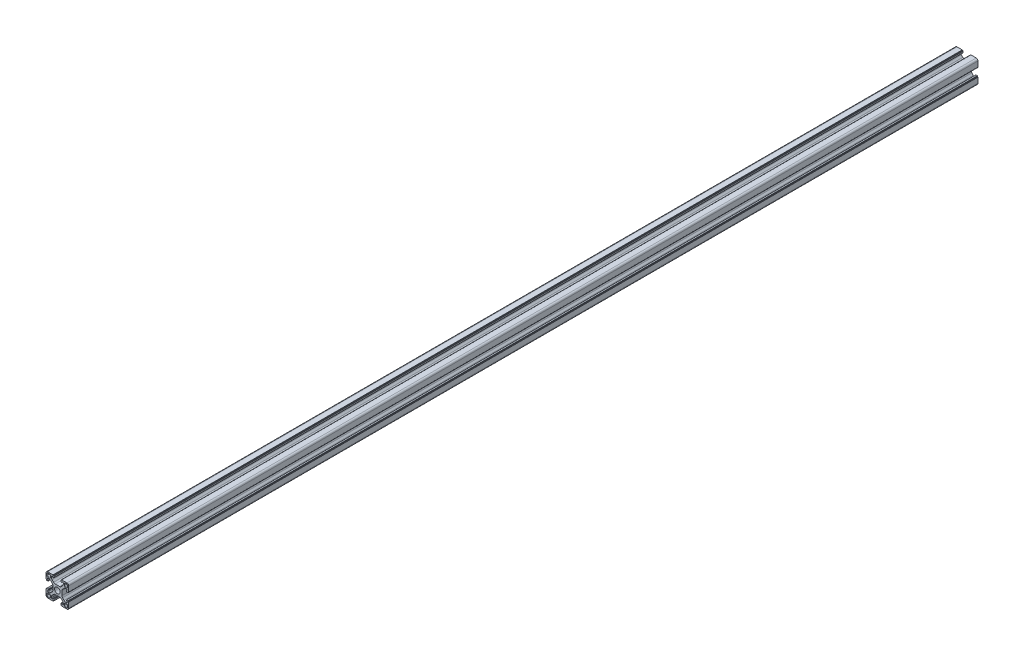
from build123d import *

# Parameters (mm, degrees)
EXTRUDE_1_DEPTH = 800


with BuildPart() as part:
    # Эскиз2 → Бобышка-Вытянуть1 (new body)
    with BuildSketch(Plane.XY):
        with BuildLine():
            Line((0.129852449, 4.683728486), (2.028633118, 4.683728486))
            ThreePointArc((2.028633118, 4.683728486), (2.793999983, 4.835969421), (3.44284668, 5.269514923))
            Line((3.44284668, 5.269514923), (4.744066011, 6.570734254))
            ThreePointArc((4.744066011, 6.570734254), (5.177611514, 7.219580952), (5.329852449, 7.984947817))
            Line((5.329852449, 7.984947817), (5.329852449, 8.883728486))
            ThreePointArc((5.329852449, 8.883728486), (5.183405839, 9.237281876), (4.829852449, 9.383728486))
            Line((4.829852449, 9.383728486), (4.72695923, 9.383728486))
            ThreePointArc((4.72695923, 9.383728486), (4.535617514, 9.345668252), (4.373405839, 9.237281876))
            Line((4.373405839, 9.237281876), (3.893075754, 8.75695179))
            ThreePointArc((3.893075754, 8.75695179), (3.811969916, 8.702758603), (3.716299058, 8.683728486))
            Line((3.716299058, 8.683728486), (3.429852449, 8.683728486))
            ThreePointArc((3.429852449, 8.683728486), (3.253075754, 8.75695179), (3.179852449, 8.933728486))
            Line((3.179852449, 8.933728486), (3.179852449, 10.082799306))
            ThreePointArc((3.179852449, 10.082799306), (3.223786432, 10.188865323), (3.329852449, 10.232799306))
            Line((3.329852449, 10.232799306), (3.829852449, 10.232799306))
            Line((3.829852449, 10.232799306), (3.829852449, 10.533728486))
            ThreePointArc((3.829852449, 10.533728486), (3.873786432, 10.639794503), (3.979852449, 10.683728486))
            Line((3.979852449, 10.683728486), (8.629852449, 10.683728486))
            ThreePointArc((8.629852449, 10.683728486), (9.690512621, 10.244388658), (10.129852449, 9.183728486))
            Line((10.129852449, 9.183728486), (10.129852449, 4.533728486))
            ThreePointArc((10.129852449, 4.533728486), (10.085918466, 4.427662469), (9.979852449, 4.383728486))
            Line((9.979852449, 4.383728486), (9.678923269, 4.383728486))
            Line((9.678923269, 4.383728486), (9.678923269, 3.883728486))
            ThreePointArc((9.678923269, 3.883728486), (9.634989287, 3.777662469), (9.528923269, 3.733728486))
            Line((9.528923269, 3.733728486), (8.379852449, 3.733728486))
            ThreePointArc((8.379852449, 3.733728486), (8.203075754, 3.80695179), (8.129852449, 3.983728486))
            Line((8.129852449, 3.983728486), (8.129852449, 4.270175095))
            ThreePointArc((8.129852449, 4.270175095), (8.148882566, 4.365845953), (8.203075754, 4.44695179))
            Line((8.203075754, 4.44695179), (8.683405839, 4.927281876))
            ThreePointArc((8.683405839, 4.927281876), (8.791792215, 5.089493551), (8.829852449, 5.280835267))
            Line((8.829852449, 5.280835267), (8.829852449, 5.383728486))
            ThreePointArc((8.829852449, 5.383728486), (8.683405839, 5.737281876), (8.329852449, 5.883728486))
            Line((8.329852449, 5.883728486), (7.43107178, 5.883728486))
            ThreePointArc((7.43107178, 5.883728486), (6.665704915, 5.731487551), (6.016858217, 5.297942048))
            Line((6.016858217, 5.297942048), (4.715638886, 3.996722717))
            ThreePointArc((4.715638886, 3.996722717), (4.282093384, 3.34787602), (4.129852449, 2.582509155))
            Line((4.129852449, 2.582509155), (4.129852449, 0.683728486))
            Line((4.129852449, 0.683728486), (4.129852449, -1.215052183))
            ThreePointArc((4.129852449, -1.215052183), (4.282093384, -1.980419048), (4.715638886, -2.629265746))
            Line((4.715638886, -2.629265746), (6.016858217, -3.930485077))
            ThreePointArc((6.016858217, -3.930485077), (6.665704915, -4.364030579), (7.43107178, -4.516271514))
            Line((7.43107178, -4.516271514), (8.329852449, -4.516271514))
            ThreePointArc((8.329852449, -4.516271514), (8.683405839, -4.369824905), (8.829852449, -4.016271514))
            Line((8.829852449, -4.016271514), (8.829852449, -3.913378295))
            ThreePointArc((8.829852449, -3.913378295), (8.791792215, -3.722036579), (8.683405839, -3.559824905))
            Line((8.683405839, -3.559824905), (8.203075754, -3.079494819))
            ThreePointArc((8.203075754, -3.079494819), (8.148882566, -2.998388982), (8.129852449, -2.902718124))
            Line((8.129852449, -2.902718124), (8.129852449, -2.616271514))
            ThreePointArc((8.129852449, -2.616271514), (8.203075754, -2.439494819), (8.379852449, -2.366271514))
            Line((8.379852449, -2.366271514), (9.528923269, -2.366271514))
            ThreePointArc((9.528923269, -2.366271514), (9.634989287, -2.410205497), (9.678923269, -2.516271514))
            Line((9.678923269, -2.516271514), (9.678923269, -3.016271514))
            Line((9.678923269, -3.016271514), (9.979852449, -3.016271514))
            ThreePointArc((9.979852449, -3.016271514), (10.085918466, -3.060205497), (10.129852449, -3.166271514))
            Line((10.129852449, -3.166271514), (10.129852449, -7.816271514))
            ThreePointArc((10.129852449, -7.816271514), (9.690512621, -8.876931686), (8.629852449, -9.316271514))
            Line((8.629852449, -9.316271514), (3.979852449, -9.316271514))
            ThreePointArc((3.979852449, -9.316271514), (3.873786432, -9.272337531), (3.829852449, -9.166271514))
            Line((3.829852449, -9.166271514), (3.829852449, -8.865342335))
            Line((3.829852449, -8.865342335), (3.329852449, -8.865342335))
            ThreePointArc((3.329852449, -8.865342335), (3.223786432, -8.821408352), (3.179852449, -8.715342335))
            Line((3.179852449, -8.715342335), (3.179852449, -7.566271514))
            ThreePointArc((3.179852449, -7.566271514), (3.253075754, -7.389494819), (3.429852449, -7.316271514))
            Line((3.429852449, -7.316271514), (3.716299058, -7.316271514))
            ThreePointArc((3.716299058, -7.316271514), (3.811969916, -7.335301631), (3.893075754, -7.389494819))
            Line((3.893075754, -7.389494819), (4.373405839, -7.869824905))
            ThreePointArc((4.373405839, -7.869824905), (4.535617514, -7.978211281), (4.72695923, -8.016271514))
            Line((4.72695923, -8.016271514), (4.829852449, -8.016271514))
            ThreePointArc((4.829852449, -8.016271514), (5.183405839, -7.869824905), (5.329852449, -7.516271514))
            Line((5.329852449, -7.516271514), (5.329852449, -6.617490845))
            ThreePointArc((5.329852449, -6.617490845), (5.177611514, -5.85212398), (4.744066011, -5.203277283))
            Line((4.744066011, -5.203277283), (3.44284668, -3.902057952))
            ThreePointArc((3.44284668, -3.902057952), (2.793999983, -3.468512449), (2.028633118, -3.316271514))
            Line((2.028633118, -3.316271514), (0.129852449, -3.316271514))
            Line((0.129852449, -3.316271514), (-1.76892822, -3.316271514))
            ThreePointArc((-1.76892822, -3.316271514), (-2.534295085, -3.468512449), (-3.183141783, -3.902057952))
            Line((-3.183141783, -3.902057952), (-4.484361114, -5.203277283))
            ThreePointArc((-4.484361114, -5.203277283), (-4.917906616, -5.85212398), (-5.070147551, -6.617490845))
            Line((-5.070147551, -6.617490845), (-5.070147551, -7.516271514))
            ThreePointArc((-5.070147551, -7.516271514), (-4.923700942, -7.869824905), (-4.570147551, -8.016271514))
            Line((-4.570147551, -8.016271514), (-4.467254332, -8.016271514))
            ThreePointArc((-4.467254332, -8.016271514), (-4.275912616, -7.978211281), (-4.113700942, -7.869824905))
            Line((-4.113700942, -7.869824905), (-3.633370856, -7.389494819))
            ThreePointArc((-3.633370856, -7.389494819), (-3.552265019, -7.335301631), (-3.456594161, -7.316271514))
            Line((-3.456594161, -7.316271514), (-3.170147551, -7.316271514))
            ThreePointArc((-3.170147551, -7.316271514), (-2.993370856, -7.389494819), (-2.920147551, -7.566271514))
            Line((-2.920147551, -7.566271514), (-2.920147551, -8.715342335))
            ThreePointArc((-2.920147551, -8.715342335), (-2.964081534, -8.821408352), (-3.070147551, -8.865342335))
            Line((-3.070147551, -8.865342335), (-3.570147551, -8.865342335))
            Line((-3.570147551, -8.865342335), (-3.570147551, -9.166271514))
            ThreePointArc((-3.570147551, -9.166271514), (-3.614081534, -9.272337531), (-3.720147551, -9.316271514))
            Line((-3.720147551, -9.316271514), (-8.370147551, -9.316271514))
            ThreePointArc((-8.370147551, -9.316271514), (-9.430807723, -8.876931686), (-9.870147551, -7.816271514))
            Line((-9.870147551, -7.816271514), (-9.870147551, -3.166271514))
            ThreePointArc((-9.870147551, -3.166271514), (-9.826213568, -3.060205497), (-9.720147551, -3.016271514))
            Line((-9.720147551, -3.016271514), (-9.419218372, -3.016271514))
            Line((-9.419218372, -3.016271514), (-9.419218372, -2.516271514))
            ThreePointArc((-9.419218372, -2.516271514), (-9.375284389, -2.410205497), (-9.269218372, -2.366271514))
            Line((-9.269218372, -2.366271514), (-8.120147551, -2.366271514))
            ThreePointArc((-8.120147551, -2.366271514), (-7.943370856, -2.439494819), (-7.870147551, -2.616271514))
            Line((-7.870147551, -2.616271514), (-7.870147551, -2.902718124))
            ThreePointArc((-7.870147551, -2.902718124), (-7.889177668, -2.998388982), (-7.943370856, -3.079494819))
            Line((-7.943370856, -3.079494819), (-8.423700942, -3.559824905))
            ThreePointArc((-8.423700942, -3.559824905), (-8.532087317, -3.722036579), (-8.570147551, -3.913378295))
            Line((-8.570147551, -3.913378295), (-8.570147551, -4.016271514))
            ThreePointArc((-8.570147551, -4.016271514), (-8.423700942, -4.369824905), (-8.070147551, -4.516271514))
            Line((-8.070147551, -4.516271514), (-7.171366882, -4.516271514))
            ThreePointArc((-7.171366882, -4.516271514), (-6.406000017, -4.364030579), (-5.75715332, -3.930485077))
            Line((-5.75715332, -3.930485077), (-4.455933989, -2.629265746))
            ThreePointArc((-4.455933989, -2.629265746), (-4.022388486, -1.980419048), (-3.870147551, -1.215052183))
            Line((-3.870147551, -1.215052183), (-3.870147551, 0.683728486))
            Line((-3.870147551, 0.683728486), (-3.870147551, 2.582509155))
            ThreePointArc((-3.870147551, 2.582509155), (-4.022388486, 3.34787602), (-4.455933989, 3.996722717))
            Line((-4.455933989, 3.996722717), (-5.75715332, 5.297942048))
            ThreePointArc((-5.75715332, 5.297942048), (-6.406000017, 5.731487551), (-7.171366882, 5.883728486))
            Line((-7.171366882, 5.883728486), (-8.070147551, 5.883728486))
            ThreePointArc((-8.070147551, 5.883728486), (-8.423700942, 5.737281876), (-8.570147551, 5.383728486))
            Line((-8.570147551, 5.383728486), (-8.570147551, 5.280835267))
            ThreePointArc((-8.570147551, 5.280835267), (-8.532087317, 5.089493551), (-8.423700942, 4.927281876))
            Line((-8.423700942, 4.927281876), (-7.943370856, 4.44695179))
            ThreePointArc((-7.943370856, 4.44695179), (-7.889177668, 4.365845953), (-7.870147551, 4.270175095))
            Line((-7.870147551, 4.270175095), (-7.870147551, 3.983728486))
            ThreePointArc((-7.870147551, 3.983728486), (-7.943370856, 3.80695179), (-8.120147551, 3.733728486))
            Line((-8.120147551, 3.733728486), (-9.269218372, 3.733728486))
            ThreePointArc((-9.269218372, 3.733728486), (-9.375284389, 3.777662469), (-9.419218372, 3.883728486))
            Line((-9.419218372, 3.883728486), (-9.419218372, 4.383728486))
            Line((-9.419218372, 4.383728486), (-9.720147551, 4.383728486))
            ThreePointArc((-9.720147551, 4.383728486), (-9.826213568, 4.427662469), (-9.870147551, 4.533728486))
            Line((-9.870147551, 4.533728486), (-9.870147551, 9.183728486))
            ThreePointArc((-9.870147551, 9.183728486), (-9.430807723, 10.244388658), (-8.370147551, 10.683728486))
            Line((-8.370147551, 10.683728486), (-3.720147551, 10.683728486))
            ThreePointArc((-3.720147551, 10.683728486), (-3.614081534, 10.639794503), (-3.570147551, 10.533728486))
            Line((-3.570147551, 10.533728486), (-3.570147551, 10.232799306))
            Line((-3.570147551, 10.232799306), (-3.070147551, 10.232799306))
            ThreePointArc((-3.070147551, 10.232799306), (-2.964081534, 10.188865323), (-2.920147551, 10.082799306))
            Line((-2.920147551, 10.082799306), (-2.920147551, 8.933728486))
            ThreePointArc((-2.920147551, 8.933728486), (-2.993370856, 8.75695179), (-3.170147551, 8.683728486))
            Line((-3.170147551, 8.683728486), (-3.456594161, 8.683728486))
            ThreePointArc((-3.456594161, 8.683728486), (-3.552265019, 8.702758603), (-3.633370856, 8.75695179))
            Line((-3.633370856, 8.75695179), (-4.113700942, 9.237281876))
            ThreePointArc((-4.113700942, 9.237281876), (-4.275912616, 9.345668252), (-4.467254332, 9.383728486))
            Line((-4.467254332, 9.383728486), (-4.570147551, 9.383728486))
            ThreePointArc((-4.570147551, 9.383728486), (-4.923700942, 9.237281876), (-5.070147551, 8.883728486))
            Line((-5.070147551, 8.883728486), (-5.070147551, 7.984947817))
            ThreePointArc((-5.070147551, 7.984947817), (-4.917906616, 7.219580952), (-4.484361114, 6.570734254))
            Line((-4.484361114, 6.570734254), (-3.183141783, 5.269514923))
            ThreePointArc((-3.183141783, 5.269514923), (-2.534295085, 4.835969421), (-1.76892822, 4.683728486))
            Line((-1.76892822, 4.683728486), (0.129852449, 4.683728486))
        make_face()
        with BuildLine():
            Line((7.029852449, 6.783728486), (8.429852449, 6.783728486))
            ThreePointArc((8.429852449, 6.783728486), (8.995537874, 7.018043061), (9.229852449, 7.583728486))
            Line((9.229852449, 7.583728486), (9.229852449, 8.983728486))
            ThreePointArc((9.229852449, 8.983728486), (8.995537874, 9.549413911), (8.429852449, 9.783728486))
            Line((8.429852449, 9.783728486), (7.029852449, 9.783728486))
            ThreePointArc((7.029852449, 9.783728486), (6.464167024, 9.549413911), (6.229852449, 8.983728486))
            Line((6.229852449, 8.983728486), (6.229852449, 7.583728486))
            ThreePointArc((6.229852449, 7.583728486), (6.464167024, 7.018043061), (7.029852449, 6.783728486))
        make_face(mode=Mode.SUBTRACT)
        with BuildLine():
            Line((6.229852449, -6.216271514), (6.229852449, -7.616271514))
            ThreePointArc((6.229852449, -7.616271514), (6.464167024, -8.181956939), (7.029852449, -8.416271514))
            Line((7.029852449, -8.416271514), (8.429852449, -8.416271514))
            ThreePointArc((8.429852449, -8.416271514), (8.995537874, -8.181956939), (9.229852449, -7.616271514))
            Line((9.229852449, -7.616271514), (9.229852449, -6.216271514))
            ThreePointArc((9.229852449, -6.216271514), (8.995537874, -5.650586089), (8.429852449, -5.416271514))
            Line((8.429852449, -5.416271514), (7.029852449, -5.416271514))
            ThreePointArc((7.029852449, -5.416271514), (6.464167024, -5.650586089), (6.229852449, -6.216271514))
        make_face(mode=Mode.SUBTRACT)
        with BuildLine():
            Line((-6.770147551, -5.416271514), (-8.170147551, -5.416271514))
            ThreePointArc((-8.170147551, -5.416271514), (-8.735832976, -5.650586089), (-8.970147551, -6.216271514))
            Line((-8.970147551, -6.216271514), (-8.970147551, -7.616271514))
            ThreePointArc((-8.970147551, -7.616271514), (-8.735832976, -8.181956939), (-8.170147551, -8.416271514))
            Line((-8.170147551, -8.416271514), (-6.770147551, -8.416271514))
            ThreePointArc((-6.770147551, -8.416271514), (-6.204462126, -8.181956939), (-5.970147551, -7.616271514))
            Line((-5.970147551, -7.616271514), (-5.970147551, -6.216271514))
            ThreePointArc((-5.970147551, -6.216271514), (-6.204462126, -5.650586089), (-6.770147551, -5.416271514))
        make_face(mode=Mode.SUBTRACT)
        with BuildLine():
            Line((-5.970147551, 7.583728486), (-5.970147551, 8.983728486))
            ThreePointArc((-5.970147551, 8.983728486), (-6.204462126, 9.549413911), (-6.770147551, 9.783728486))
            Line((-6.770147551, 9.783728486), (-8.170147551, 9.783728486))
            ThreePointArc((-8.170147551, 9.783728486), (-8.735832976, 9.549413911), (-8.970147551, 8.983728486))
            Line((-8.970147551, 8.983728486), (-8.970147551, 7.583728486))
            ThreePointArc((-8.970147551, 7.583728486), (-8.735832976, 7.018043061), (-8.170147551, 6.783728486))
            Line((-8.170147551, 6.783728486), (-6.770147551, 6.783728486))
            ThreePointArc((-6.770147551, 6.783728486), (-6.204462126, 7.018043061), (-5.970147551, 7.583728486))
        make_face(mode=Mode.SUBTRACT)
        with BuildLine():
            ThreePointArc((2.629852449, 0.683728486), (1.897619402, 2.451495439), (0.129852449, 3.183728486))
            ThreePointArc((0.129852449, 3.183728486), (-1.637914504, 2.451495439), (-2.370147551, 0.683728486))
            ThreePointArc((-2.370147551, 0.683728486), (-1.637914504, -1.084038467), (0.129852449, -1.816271514))
            ThreePointArc((0.129852449, -1.816271514), (1.897619402, -1.084038467), (2.629852449, 0.683728486))
        make_face(mode=Mode.SUBTRACT)
    extrude(amount=EXTRUDE_1_DEPTH)


solid = part.part
